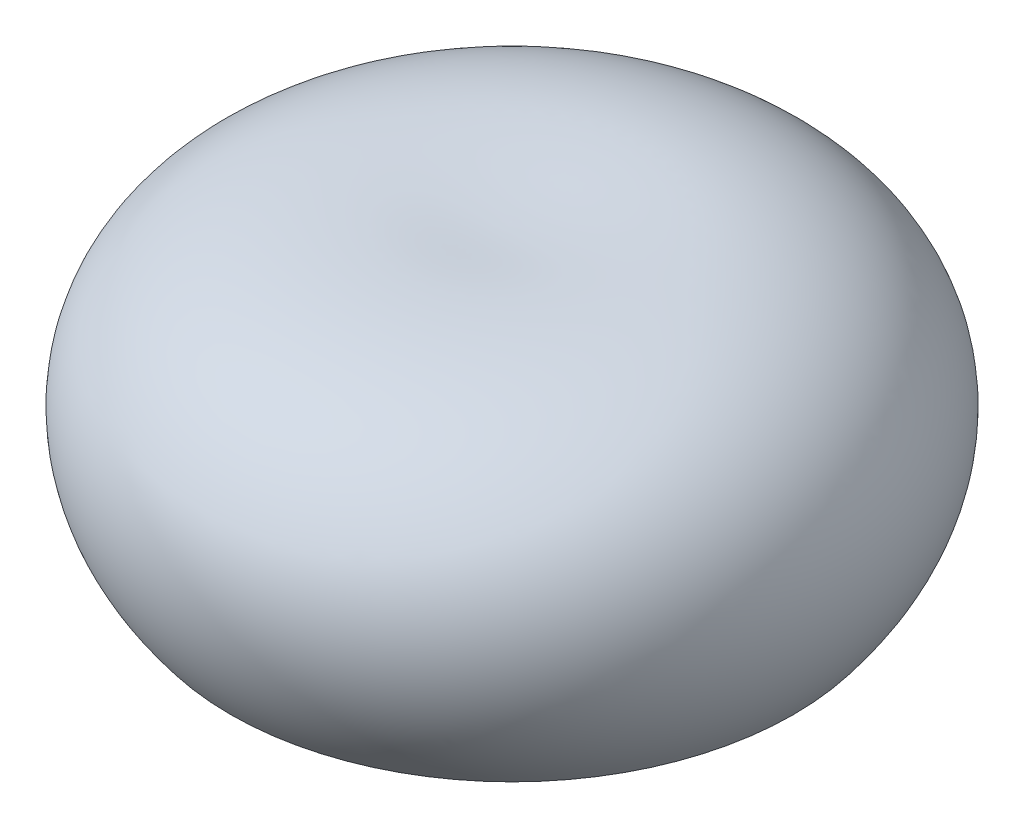
from build123d import *


with BuildPart() as part:
    # 草图3 → 旋转1 (revolve)
    with BuildSketch(Plane.XY):
        with BuildLine():
            Line((0, 7), (0, 0))
            Line((0, 0), (6.871524, 0))
            add(Edge.make_bspline(
                [(0, 7), (0.073827133, 6.999533892), (0.178318357, 6.998874186), (0.306371082, 7.001499066), (0.380532001, 7.003447371), (0.44163275, 7.005414874), (0.495099375, 7.007375358), (0.543337939, 7.009328467), (0.587692174, 7.011274662), (0.62900892, 7.013208302), (0.667864574, 7.01513245), (0.704674056, 7.01704083), (0.739746516, 7.018935719), (0.773321365, 7.020815477), (0.805587195, 7.022680946), (0.836696698, 7.024531001), (0.866775289, 7.026364097), (0.895926819, 7.028182386), (0.92424, 7.029984755), (0.951789678, 7.031768518), (0.978640164, 7.033538818), (1.004847801, 7.035290763), (1.030461401, 7.037026909), (1.055524621, 7.038747334), (1.080075561, 7.040450285), (1.104148873, 7.042135989), (1.127774491, 7.043805743), (1.150980061, 7.045459817), (1.173790345, 7.047096538), (1.196228349, 7.048715852), (1.21831425, 7.050319891), (1.240066936, 7.05190598), (1.261503173, 7.053476977), (1.282639187, 7.055030127), (1.303489485, 7.056567608), (1.324067415, 7.058089226), (1.344385372, 7.05959381), (1.364454785, 7.06108041), (1.38428631, 7.062553647), (1.403890354, 7.064008392), (1.423276267, 7.065448232), (1.442452636, 7.066870081), (1.461427601, 7.068276548), (1.480208588, 7.069666736), (1.498802901, 7.071041002), (1.517217542, 7.072399364), (1.535458874, 7.073741376), (1.553532799, 7.075068082), (1.571445213, 7.076376654), (1.589201149, 7.077671204), (1.606806139, 7.078949351), (1.624264792, 7.080211552), (1.641582107, 7.081457816), (1.65876215, 7.082687569), (1.675808752, 7.08390315), (1.692726084, 7.085102192), (1.709518068, 7.086285448), (1.726188441, 7.087452225), (1.742740379, 7.088604811), (1.759177426, 7.089740488), (1.775502371, 7.090861982), (1.791718366, 7.091967091), (1.807828401, 7.09305595), (1.823835055, 7.094130165), (1.839741065, 7.095189049), (1.85554896, 7.096234019), (1.871261098, 7.097259952), (1.886879701, 7.098273623), (1.902406998, 7.099271914), (1.917845712, 7.100253549), (1.933197649, 7.101221273), (1.948464748, 7.102171391), (1.963648643, 7.103109491), (1.978751408, 7.104029595), (1.993774643, 7.104937619), (2.008720735, 7.105827809), (2.02359065, 7.106705638), (2.038386356, 7.107566375), (2.053109061, 7.108412093), (2.067760644, 7.109244979), (2.082342731, 7.110060174), (2.096856351, 7.110862757), (2.111302695, 7.111649647), (2.125683354, 7.112421865), (2.139999726, 7.113178548), (2.154253027, 7.113921927), (2.16844436, 7.114650026), (2.182574738, 7.115362568), (2.196645325, 7.116062617), (2.210657444, 7.116744277), (2.224611994, 7.11741581), (2.238510113, 7.11806838), (2.252352674, 7.118710787), (2.266140749, 7.119334935), (2.27987541, 7.11994616), (2.293557055, 7.120543437), (2.307187085, 7.121125216), (2.320766088, 7.121693253), (2.334295403, 7.122247514), (2.347775404, 7.122786663), (2.361207128, 7.123309997), (2.374590743, 7.123821817), (2.387927781, 7.124317303), (2.40121842, 7.124799912), (2.414463811, 7.125266091), (2.42766443, 7.125720992), (2.440821131, 7.126159489), (2.453934464, 7.126584694), (2.46700514, 7.126995587), (2.480033455, 7.127393071), (2.493020504, 7.127774283), (2.505966464, 7.128144259), (2.518872515, 7.128497291), (2.53173881, 7.128839321), (2.544566191, 7.12916436), (2.557354824, 7.129478356), (2.570105535, 7.129775418), (2.582818505, 7.130061396), (2.595494544, 7.13033055), (2.608134199, 7.130588093), (2.620737876, 7.130830963), (2.633305882, 7.131060023), (2.645838889, 7.131275039), (2.658337228, 7.131476135), (2.670801578, 7.131662797), (2.683232241, 7.131837195), (2.695629583, 7.131997104), (2.707994257, 7.132143137), (2.720326263, 7.132275252), (2.732626277, 7.132392878), (2.74489461, 7.132498364), (2.757131624, 7.132588915), (2.769337959, 7.132667332), (2.781513968, 7.132731228), (2.793659642, 7.132781331), (2.805775651, 7.132817122), (2.817861991, 7.132839974), (2.829919332, 7.132850856), (2.841948005, 7.132844583), (2.853948349, 7.132828886), (2.865920688, 7.132796049), (2.877865028, 7.132751192), (2.889781706, 7.132693532), (2.901671376, 7.13262113), (2.913534055, 7.132536469), (2.925370399, 7.132437615), (2.937180391, 7.132323773), (2.948964424, 7.132200075), (2.960722739, 7.132058795), (2.972455433, 7.13190768), (2.984163107, 7.131741519), (2.995845773, 7.131561314), (3.007504115, 7.131368402), (3.019137788, 7.131162311), (3.030747477, 7.130943692), (3.042332803, 7.130710275), (3.053894828, 7.130464707), (3.065433155, 7.130204358), (3.076948499, 7.129931482), (3.088440504, 7.129645373), (3.099909865, 7.129346746), (3.111356854, 7.129033383), (3.122781534, 7.128707543), (3.134184204, 7.128368389), (3.145564902, 7.128016801), (3.156923889, 7.127650437), (3.168261235, 7.127271563), (3.179577238, 7.126879419), (3.190872277, 7.126474928), (3.202146231, 7.126055113), (3.213399629, 7.125624928), (3.224632274, 7.125179472), (3.235844622, 7.124721627), (3.247036956, 7.124250438), (3.258209338, 7.123767022), (3.269361943, 7.123268103), (3.280494695, 7.122759108), (3.291607959, 7.122234128), (3.302701711, 7.121699042), (3.313776343, 7.121148487), (3.324832028, 7.12058567), (3.335869035, 7.120009645), (3.346887376, 7.119420627), (3.357887055, 7.11881868), (3.368868395, 7.118203643), (3.379831407, 7.117575692), (3.390776409, 7.116934577), (3.401703467, 7.116281047), (3.412612724, 7.115612321), (3.423504444, 7.11493271), (3.434378498, 7.114240055), (3.44523475, 7.113532344), (3.456074141, 7.112813747), (3.466896485, 7.112081762), (3.477701817, 7.111336625), (3.488489885, 7.110579101), (3.499261125, 7.109806343), (3.510016192, 7.109022811), (3.520754863, 7.108225739), (3.531476876, 7.107415787), (3.542182545, 7.106592699), (3.552872223, 7.105756727), (3.563545915, 7.104907913), (3.574203518, 7.104045357), (3.584845313, 7.103172137), (3.595471594, 7.102283709), (3.606082229, 7.101382573), (3.616677284, 7.100469781), (3.627256687, 7.099544119), (3.637820904, 7.098603366), (3.648370328, 7.097651946), (3.658904656, 7.096686772), (3.669423667, 7.095708786), (3.67992769, 7.094717923), (3.690416948, 7.093713383), (3.700891776, 7.092698276), (3.71135197, 7.091667419), (3.721797724, 7.090625877), (3.732229124, 7.089571093), (3.742645685, 7.088501635), (3.753048344, 7.087420478), (3.763436836, 7.086328227), (3.773811426, 7.085220735), (3.784171725, 7.084100672), (3.794518457, 7.082968843), (3.804851134, 7.081823846), (3.815170148, 7.080665884), (3.825475479, 7.079494772), (3.835767183, 7.078311001), (3.84604542, 7.077113435), (3.856310283, 7.075905342), (3.866561442, 7.074681465), (3.876799547, 7.073446927), (3.887024559, 7.07219893), (3.897236473, 7.070937498), (3.907435665, 7.069665283), (3.917621172, 7.0683776), (3.927794251, 7.067078815), (3.937954277, 7.065766934), (3.948101629, 7.064441996), (3.958235857, 7.063103463), (3.968358062, 7.06175425), (3.978467235, 7.06038965), (3.988564318, 7.059013852), (3.998648667, 7.057624891), (4.008720701, 7.056223059), (4.018780237, 7.054807393), (4.028827819, 7.053381402), (4.038862939, 7.051939503), (4.048886063, 7.050486965), (4.058897075, 7.049020967), (4.068895971, 7.047541534), (4.0788832, 7.04605133), (4.088857991, 7.044545536), (4.098821127, 7.043029031), (4.108772433, 7.041498786), (4.118711818, 7.039956047), (4.128639788, 7.038399785), (4.138555747, 7.036830796), (4.148460496, 7.035249914), (4.158353495, 7.033655841), (4.168235195, 7.032048984), (4.178105515, 7.030428832), (4.18796423, 7.02879606), (4.197811442, 7.027149606), (4.207647567, 7.025491953), (4.217472252, 7.023820992), (4.227285893, 7.022136783), (4.237088274, 7.020439997), (4.246879619, 7.018729994), (4.256659491, 7.017006548), (4.266428764, 7.015272353), (4.276186825, 7.013522435), (4.285934358, 7.011762152), (4.295670652, 7.009987873), (4.305396008, 7.008200935), (4.315110558, 7.006400587), (4.324814837, 7.004589353), (4.334507582, 7.002762599), (4.344190052, 7.000924937), (4.35386173, 6.999073937), (4.36352275, 6.99720998), (4.373173066, 6.995332832), (4.382813104, 6.993442966), (4.392442644, 6.991539612), (4.40206195, 6.989625421), (4.411669961, 6.987695421), (4.421268286, 6.98575531), (4.430855693, 6.983799644), (4.440433174, 6.981832979), (4.450000162, 6.979852863), (4.459556867, 6.977859996), (4.469103214, 6.975854), (4.478639363, 6.973834416), (4.488165747, 6.971804498), (4.49768153, 6.969758755), (4.507187098, 6.967700589), (4.516683109, 6.965631446), (4.526168423, 6.963546451), (4.535644276, 6.961450921), (4.545110133, 6.95934238), (4.554565447, 6.957218423), (4.564011046, 6.955084215), (4.573446596, 6.952935655), (4.582872499, 6.950775294), (4.592288195, 6.948599592), (4.601694389, 6.94641305), (4.61109067, 6.944212776), (4.620477393, 6.941999965), (4.6298544, 6.939773941), (4.63922141, 6.937534937), (4.648578436, 6.935282993), (4.657925713, 6.933017712), (4.667263621, 6.930740315), (4.676591598, 6.928447484), (4.6859105, 6.926144058), (4.695219492, 6.923826975), (4.704518775, 6.921496728), (4.713808688, 6.919154318), (4.723088659, 6.916796511), (4.732359547, 6.914428003), (4.741621012, 6.912046127), (4.750872387, 6.909649623), (4.760115045, 6.907242158), (4.769347568, 6.904819891), (4.778570929, 6.90238495), (4.787784742, 6.899936539), (4.796989787, 6.89747724), (4.806185087, 6.895003064), (4.815370786, 6.892514574), (4.824547673, 6.890015011), (4.833715144, 6.887502128), (4.842872512, 6.88497467), (4.852021466, 6.882435993), (4.861160709, 6.879882955), (4.870291028, 6.87731686), (4.879411734, 6.874737958), (4.888523519, 6.872145992), (4.897625582, 6.869539672), (4.906719263, 6.866922171), (4.915803066, 6.864289775), (4.924877807, 6.861644991), (4.933943581, 6.858986975), (4.94299965, 6.856314704), (4.952047615, 6.853631002), (4.961085825, 6.850932877), (4.970115368, 6.848222194), (4.979134964, 6.845496485), (4.988146403, 6.84276022), (4.997148149, 6.84000868), (5.006141431, 6.83724522), (5.015125011, 6.834466485), (5.02410015, 6.831677299), (5.033065706, 6.828872897), (5.042022067, 6.826054552), (5.050970484, 6.823225166), (5.059908979, 6.820380913), (5.068838767, 6.817523916), (5.077759314, 6.814652837), (5.086671321, 6.811768821), (5.095574521, 6.808872058), (5.104468083, 6.805961029), (5.113352619, 6.803036595), (5.1222286, 6.800100168), (5.131095614, 6.797148503), (5.139954357, 6.794185351), (5.148803358, 6.791206655), (5.157643688, 6.788216255), (5.16647445, 6.785210206), (5.175297627, 6.782194633), (5.18411069, 6.779161498), (5.192915495, 6.776116863), (5.201711701, 6.773059081), (5.210498474, 6.769986725), (5.21927674, 6.766902107), (5.228045508, 6.763802744), (5.236806024, 6.760690887), (5.245557278, 6.757564957), (5.254300049, 6.754425875), (5.26303357, 6.751272767), (5.271758788, 6.748106997), (5.280474823, 6.744927049), (5.289181844, 6.741732494), (5.29788063, 6.73852635), (5.306569858, 6.735304461), (5.315250922, 6.732071155), (5.323922602, 6.728822598), (5.332586169, 6.725562394), (5.341239407, 6.722285342), (5.349885207, 6.718998409), (5.358520913, 6.715694395), (5.367149003, 6.712379128), (5.375767722, 6.709048695), (5.384377988, 6.705706009), (5.392978965, 6.702348911), (5.401571278, 6.698977818), (5.410154755, 6.695592637), (5.418730316, 6.692195344), (5.427295533, 6.688781343), (5.435853353, 6.685357356), (5.444400779, 6.681916555), (5.452940589, 6.67846403), (5.4614706, 6.674995864), (5.469992406, 6.671514836), (5.478504862, 6.668019623), (5.487009418, 6.664512264), (5.495504116, 6.660988362), (5.503990977, 6.657453258), (5.512468388, 6.65390261), (5.520937205, 6.650338931), (5.529397195, 6.64676087), (5.537848221, 6.643168893), (5.546290215, 6.639562842), (5.5547233, 6.635943001), (5.563147213, 6.632308328), (5.571563357, 6.628662494), (5.579969204, 6.624999241), (5.588367621, 6.621325253), (5.596756017, 6.61763451), (5.605136592, 6.61393211), (5.613507338, 6.610213829), (5.621869127, 6.606481658), (5.630222843, 6.60273681), (5.638567155, 6.598977057), (5.646902606, 6.595202545), (5.655229219, 6.591415123), (5.663546642, 6.587612553), (5.671855457, 6.583796843), (5.680155206, 6.579966985), (5.688445961, 6.576122804), (5.696727209, 6.572263539), (5.705000773, 6.568392043), (5.713264489, 6.564504733), (5.721519508, 6.560603741), (5.729765803, 6.55668899), (5.738002068, 6.55275878), (5.746230019, 6.548815672), (5.754448851, 6.544857976), (5.762658307, 6.540884486), (5.770859898, 6.536899), (5.779051608, 6.532897702), (5.787234608, 6.528882671), (5.795408715, 6.524854192), (5.803572831, 6.520809379), (5.811728496, 6.516752012), (5.819875135, 6.512679588), (5.828012468, 6.508592886), (5.836140991, 6.50449189), (5.844259923, 6.500375398), (5.852370543, 6.496245929), (5.860471776, 6.492102014), (5.868563261, 6.487942623), (5.87664547, 6.483768374), (5.884720161, 6.479582312), (5.892783757, 6.475378525), (5.900838844, 6.47116166), (5.908885114, 6.466930805), (5.916921597, 6.462684756), (5.924949633, 6.458424748), (5.932967338, 6.454148537), (5.940977502, 6.449860053), (5.948976347, 6.445554492), (5.956967513, 6.441236998), (5.964947875, 6.436902452), (5.972920211, 6.432554705), (5.980883037, 6.428191956), (5.988835952, 6.423813497), (5.996780244, 6.41942166), (6.004715096, 6.415014956), (6.01263996, 6.410592415), (6.020556163, 6.406157004), (6.028462416, 6.401705237), (6.036359963, 6.397240168), (6.044247324, 6.392758592), (6.052125055, 6.388262424), (6.059994643, 6.38375275), (6.067853728, 6.379226947), (6.075703555, 6.374686283), (6.083544222, 6.370131823), (6.091375221, 6.365561786), (6.099196402, 6.360976492), (6.107008259, 6.356376782), (6.114810255, 6.35176174), (6.122602508, 6.34713157), (6.130385168, 6.342486304), (6.138159628, 6.337827926), (6.145923267, 6.333152623), (6.153677365, 6.32846275), (6.161421526, 6.323757433), (6.169156335, 6.319037634), (6.176881721, 6.314302893), (6.184596204, 6.309551146), (6.192302793, 6.304786938), (6.199998088, 6.300005435), (6.207684915, 6.295210528), (6.215361251, 6.290399829), (6.223027942, 6.285573499), (6.230684163, 6.280731428), (6.238331834, 6.275875785), (6.245968443, 6.271003471), (6.253595824, 6.266116697), (6.261212544, 6.26121356), (6.268819702, 6.256295258), (6.276417463, 6.251362883), (6.284004924, 6.2464142), (6.29158282, 6.241451023), (6.299149384, 6.23646998), (6.306707815, 6.231476944), (6.314254907, 6.226466541), (6.321791744, 6.2214401), (6.329319857, 6.216399897), (6.33683667, 6.211342421), (6.344343619, 6.206270315), (6.351841259, 6.201184045), (6.359326406, 6.196078783), (6.366804294, 6.190962021), (6.374269679, 6.18582627), (6.381725764, 6.180676366), (6.389172353, 6.175511512), (6.396607654, 6.170329618), (6.404032733, 6.165132224), (6.411448329, 6.159920842), (6.41885173, 6.154691153), (6.426246232, 6.149447496), (6.433629763, 6.14418714), (6.441004374, 6.138912758), (6.448366686, 6.133620431), (6.455719187, 6.128313298), (6.463061071, 6.122990563), (6.470392195, 6.11765124), (6.477713217, 6.112296238), (6.485024095, 6.106925493), (6.492324137, 6.101538513), (6.499612814, 6.096135378), (6.506891576, 6.090717254), (6.514159147, 6.085282423), (6.521416328, 6.079831188), (6.528662868, 6.074364322), (6.535899543, 6.068882511), (6.543124112, 6.063383242), (6.550338616, 6.057868532), (6.557540979, 6.052335903), (6.564734231, 6.046789729), (6.571915622, 6.041226003), (6.579086321, 6.035646344), (6.58624622, 6.030050182), (6.593395606, 6.024438728), (6.600532037, 6.018808795), (6.607659703, 6.01316536), (6.614775621, 6.007504219), (6.621880335, 6.00182616), (6.628974316, 5.996132518), (6.636056393, 5.990422166), (6.643127774, 5.984695859), (6.650188613, 5.978953446), (6.657237361, 5.973193433), (6.664274485, 5.967416741), (6.671301723, 5.961625471), (6.678316701, 5.955816005), (6.685320437, 5.949990388), (6.692312838, 5.944147703), (6.699294373, 5.93828964), (6.70626378, 5.932413963), (6.713221842, 5.926522002), (6.720168473, 5.92061326), (6.72710383, 5.914687921), (6.734027814, 5.908746255), (6.74093982, 5.902786841), (6.747840861, 5.896811238), (6.754729475, 5.890818094), (6.761606891, 5.884809202), (6.768471887, 5.878782783), (6.775325873, 5.872740111), (6.7821679, 5.866680106), (6.788997897, 5.860602695), (6.795816904, 5.854509413), (6.802622934, 5.848397668), (6.80941793, 5.842270001), (6.816200905, 5.836125305), (6.822971003, 5.829962645), (6.829729916, 5.823783883), (6.836477332, 5.817588326), (6.843210595, 5.811373438), (6.849934374, 5.805144298), (6.856643941, 5.79889577), (6.863342046, 5.79263085), (6.870028327, 5.78634878), (6.876702009, 5.780049093), (6.883363037, 5.773731737), (6.890012386, 5.767397736), (6.896649052, 5.761046031), (6.903273089, 5.754676689), (6.909885403, 5.748290648), (6.916485362, 5.741886912), (6.923072103, 5.735464943), (6.929646105, 5.729025572), (6.936208465, 5.722569908), (6.942757431, 5.7160955), (6.949294139, 5.70960384), (6.955818424, 5.703094757), (6.962329499, 5.696567794), (6.968827171, 5.690022437), (6.975313488, 5.683460713), (6.981786483, 5.676880997), (6.988245459, 5.670282285), (6.994692608, 5.66366672), (7.001126145, 5.65703257), (7.007547938, 5.650381633), (7.013955148, 5.643711504), (7.020350612, 5.637024899), (7.026731837, 5.630319107), (7.033100301, 5.623595863), (7.039455576, 5.616854439), (7.045797881, 5.610095356), (7.052126638, 5.603317735), (7.058441296, 5.596521406), (7.064743924, 5.589708287), (7.071032997, 5.582876621), (7.077307242, 5.576025256), (7.083570042, 5.569157588), (7.089817601, 5.562270482), (7.09605199, 5.555365163), (7.102272687, 5.548441488), (7.108479705, 5.541499467), (7.114673022, 5.534539083), (7.120852695, 5.527560387), (7.127019059, 5.520563337), (7.133170693, 5.513547313), (7.139309051, 5.506513255), (7.145433062, 5.499460226), (7.151542742, 5.492388248), (7.157639101, 5.485298187), (7.163721055, 5.47818911), (7.169788822, 5.471061491), (7.17584236, 5.463914679), (7.181881859, 5.456749448), (7.187907074, 5.449564979), (7.193918168, 5.442362298), (7.199914135, 5.435139955), (7.205896069, 5.427898866), (7.211864309, 5.420639572), (7.217816016, 5.413359478), (7.223755295, 5.406062212), (7.229679087, 5.398745005), (7.23558862, 5.391409061), (7.24148172, 5.384052704), (7.247362726, 5.376679333), (7.253226039, 5.369284553), (7.259076625, 5.361871909), (7.264911214, 5.354438881), (7.270731246, 5.34698687), (7.276536603, 5.339515775), (7.282326185, 5.332024748), (7.288101644, 5.324514985), (7.293860524, 5.316984598), (7.299604355, 5.309434766), (7.305333219, 5.301865627), (7.311048043, 5.294277792), (7.316745151, 5.286668502), (7.322428806, 5.279040867), (7.328095191, 5.27139246), (7.333748018, 5.26372561), (7.339383602, 5.256037596), (7.345003441, 5.248329774), (7.350607576, 5.24060226), (7.356197062, 5.232855479), (7.361769311, 5.225087567), (7.367327047, 5.217300387), (7.372867655, 5.209492402), (7.378392764, 5.201664441), (7.383901626, 5.193816306), (7.389395182, 5.185948552), (7.394870551, 5.178058945), (7.400331839, 5.170150568), (7.40577609, 5.162221364), (7.411202687, 5.154271155), (7.416614075, 5.146301047), (7.42200876, 5.138310353), (7.427387187, 5.130299265), (7.432747628, 5.122266964), (7.438093498, 5.114215056), (7.44342071, 5.106141162), (7.448732261, 5.098047149), (7.454025617, 5.089931807), (7.459304585, 5.08179716), (7.464564054, 5.073639892), (7.469806842, 5.065462052), (7.475033465, 5.057263742), (7.480242048, 5.04904377), (7.485434295, 5.040803095), (7.490608058, 5.032540697), (7.495765282, 5.024258003), (7.500904358, 5.015953469), (7.506026237, 5.007627892), (7.511130254, 4.99928086), (7.516216356, 4.990912346), (7.521285551, 4.982522624), (7.526336177, 4.974110691), (7.531369553, 4.965677541), (7.5363842, 4.957222623), (7.54138155, 4.948746455), (7.546360421, 4.940248338), (7.55132169, 4.931728645), (7.556263132, 4.923186421), (7.561187918, 4.914623164), (7.566093037, 4.906037288), (7.570982211, 4.897430622), (7.575849112, 4.888799728), (7.580700946, 4.880148715), (7.58553133, 4.871473957), (7.590344925, 4.862778096), (7.595138433, 4.85405963), (7.599912969, 4.845318517), (7.60466865, 4.836555148), (7.609405502, 4.827769028), (7.614124155, 4.818961177), (7.618821179, 4.810129596), (7.623502644, 4.801277186), (7.628160136, 4.792399492), (7.632802297, 4.783501245), (7.63742173, 4.774578558), (7.64202277, 4.765633539), (7.646605203, 4.756666055), (7.651165622, 4.747674378), (7.655708216, 4.738660969), (7.660228902, 4.7296231), (7.664730914, 4.72056306), (7.66921221, 4.711478833), (7.673673795, 4.702371913), (7.678115293, 4.693241442), (7.682535109, 4.684087146), (7.68693506, 4.67490908), (7.691315256, 4.665707777), (7.695673014, 4.656481969), (7.700011109, 4.647233459), (7.704328227, 4.637960648), (7.70862543, 4.628664337), (7.712900165, 4.619343015), (7.717154186, 4.609997981), (7.721387369, 4.600629167), (7.725598402, 4.591235652), (7.729788165, 4.581817835), (7.733957334, 4.572376012), (7.738104511, 4.562909708), (7.742229312, 4.553418907), (7.746332491, 4.543903129), (7.750414558, 4.534363061), (7.754473204, 4.524797248), (7.75851153, 4.515207953), (7.762526542, 4.505593105), (7.766519771, 4.495953621), (7.770489039, 4.486288002), (7.774439203, 4.476598502), (7.778363151, 4.466882091), (7.7822669, 4.457141611), (7.786145474, 4.447374794), (7.79000259, 4.437583259), (7.793836733, 4.427765933), (7.797647649, 4.417922852), (7.80143588, 4.408054019), (7.805199598, 4.398159195), (7.808939908, 4.38823847), (7.812656525, 4.378291614), (7.816351124, 4.368319032), (7.820019587, 4.358319207), (7.823666138, 4.348293933), (7.827286398, 4.338241377), (7.830885147, 4.328163501), (7.834458135, 4.318058442), (7.838005484, 4.307925933), (7.84153145, 4.297767564), (7.845029471, 4.28758128), (7.848505208, 4.27736893), (7.851955197, 4.267129317), (7.855378833, 4.256861589), (7.858779006, 4.246567484), (7.862153266, 4.236245406), (7.865501822, 4.225895879), (7.868826293, 4.215518752), (7.872123952, 4.205113925), (7.875396361, 4.194681334), (7.878642135, 4.184220543), (7.881862079, 4.173731475), (7.88505633, 4.163214599), (7.888223225, 4.152669079), (7.891364118, 4.142094997), (7.894479541, 4.131492595), (7.897566006, 4.120860859), (7.900627452, 4.11020103), (7.903660986, 4.099512179), (7.906668909, 4.088794475), (7.909646911, 4.078047051), (7.912599622, 4.067270617), (7.915523386, 4.056464829), (7.918419176, 4.045629298), (7.921288755, 4.034764571), (7.924128358, 4.023869323), (7.926940354, 4.012944268), (7.929724655, 4.001989373), (7.932479291, 3.991003809), (7.935206875, 3.979988394), (7.937903098, 3.968941985), (7.940572778, 3.957865509), (7.943212509, 3.946758132), (7.945822874, 3.935619492), (7.948402355, 3.924449571), (7.950953662, 3.91324866), (7.953474714, 3.90201628), (7.955965461, 3.8907525), (7.958426906, 3.879457277), (7.96085662, 3.868129751), (7.963256643, 3.856770435), (7.965625852, 3.845378752), (7.967963543, 3.833954963), (7.970271131, 3.822498753), (7.972545235, 3.811009386), (7.974791247, 3.799487718), (7.977002638, 3.787932806), (7.979182691, 3.776344696), (7.981332064, 3.764723493), (7.983447538, 3.753068275), (7.985532121, 3.741379711), (7.987582751, 3.729657249), (7.98960087, 3.717900542), (7.991586162, 3.706109915), (7.993536398, 3.694284285), (7.995456365, 3.682424541), (7.997339946, 3.670529353), (7.999189464, 3.658599168), (8.001007683, 3.646634105), (8.002787223, 3.634633008), (8.004536478, 3.62259694), (8.006247855, 3.610524735), (8.007924962, 3.598416354), (8.009567183, 3.586271694), (8.011172681, 3.574090186), (8.012744497, 3.561872309), (8.014277452, 3.549617029), (8.015777601, 3.537325224), (8.017237739, 3.524995639), (8.018663076, 3.512628652), (8.020051363, 3.500223317), (8.021400739, 3.487779811), (8.02271432, 3.475297839), (8.023988897, 3.462777393), (8.025226396, 3.450217738), (8.02642385, 3.437618917), (8.027584078, 3.4249809), (8.028705416, 3.412303219), (8.029785868, 3.399585406), (8.030828287, 3.386827063), (8.031829946, 3.374028297), (8.032792442, 3.361188618), (8.033712735, 3.348307805), (8.034594626, 3.335385503), (8.035432523, 3.322421316), (8.036232716, 3.309415376), (8.036987673, 3.296366867), (8.037703413, 3.28327587), (8.038375121, 3.270141777), (8.039004165, 3.256964369), (8.039589992, 3.243743285), (8.040133264, 3.230477899), (8.040632009, 3.217168145), (8.041087271, 3.203813753), (8.041497124, 3.190414334), (8.041862089, 3.176969254), (8.042181933, 3.163478505), (8.042457114, 3.149941436), (8.042686211, 3.136358027), (8.042868116, 3.122727276), (8.043002966, 3.109049526), (8.043091166, 3.095323779), (8.043131047, 3.081549694), (8.043122814, 3.067726945), (8.043067362, 3.053855188), (8.04296086, 3.039933773), (8.04280576, 3.025962358), (8.042602169, 3.011940256), (8.042346997, 2.997867502), (8.042040724, 2.983743088), (8.041684381, 2.969566963), (8.041273415, 2.955338587), (8.040812957, 2.941057128), (8.040299088, 2.92672235), (8.039730428, 2.912333299), (8.039110082, 2.897889817), (8.038433611, 2.883391077), (8.037703, 2.868836945), (8.036915195, 2.85422658), (8.036074221, 2.839559034), (8.035173081, 2.82483438), (8.03421799, 2.810051161), (8.033202376, 2.795209791), (8.032129373, 2.780308671), (8.030997805, 2.765347485), (8.029804215, 2.750325455), (8.028551351, 2.735241983), (8.027237389, 2.720096513), (8.025861056, 2.704888441), (8.024423446, 2.689616569), (8.022920881, 2.674280184), (8.021355631, 2.658878263), (8.019722416, 2.643410687), (8.018027201, 2.627876053), (8.016263955, 2.612273595), (8.01443288, 2.596602491), (8.012533406, 2.580862105), (8.010567073, 2.565051115), (8.008528188, 2.549169156), (8.006420905, 2.533214145), (8.004239189, 2.517186166), (8.001986131, 2.501083346), (7.999660351, 2.484905098), (7.997259206, 2.468650612), (7.994781904, 2.452318482), (7.992228021, 2.435907619), (7.98959568, 2.419416493), (7.986884586, 2.402843993), (7.984093493, 2.386188823), (7.981221484, 2.369449912), (7.978266317, 2.352626079), (7.975226642, 2.335715736), (7.972104579, 2.318716846), (7.968892204, 2.301629026), (7.96559505, 2.284449531), (7.962206088, 2.267177909), (7.958728562, 2.249811802), (7.955156789, 2.232350479), (7.951493025, 2.214791073), (7.947732399, 2.197132316), (7.943875738, 2.179371942), (7.939918716, 2.161508607), (7.935863557, 2.14353962), (7.931702023, 2.125463888), (7.927439857, 2.107277885), (7.923068733, 2.088980571), (7.918591011, 2.070568759), (7.914001674, 2.052040833), (7.909298838, 2.033394035), (7.904482121, 2.014625191), (7.899546036, 1.995732206), (7.894492603, 1.976711425), (7.88931318, 1.957561618), (7.884011447, 1.938277563), (7.878579797, 1.91885769), (7.873017173, 1.899297716), (7.867320676, 1.879594367), (7.861487338, 1.85974353), (7.855512469, 1.839741943), (7.849394428, 1.819584894), (7.843126049, 1.799269221), (7.836707928, 1.778789176), (7.830132832, 1.758140863), (7.823398223, 1.737319056), (7.8164993, 1.716318122), (7.80943092, 1.695133099), (7.802186127, 1.673758776), (7.794764789, 1.652187377), (7.787156529, 1.630413955), (7.779357217, 1.608430762), (7.771361341, 1.586230611), (7.763160488, 1.563806258), (7.754750512, 1.541148197), (7.746120689, 1.518248683), (7.737265217, 1.495097435), (7.728174395, 1.471684966), (7.718839043, 1.448000361), (7.709251789, 1.424031225), (7.699397336, 1.399766559), (7.68926991, 1.375190965), (7.678852073, 1.350291485), (7.668136035, 1.325050659), (7.65710216, 1.299452572), (7.645736149, 1.273478008), (7.634023807, 1.247105041), (7.621942698, 1.220313153), (7.609474637, 1.193076087), (7.596596098, 1.165366551), (7.583281972, 1.137153935), (7.569501749, 1.10840511), (7.555228619, 1.079079725), (7.540422008, 1.049136817), (7.525047037, 1.018525177), (7.509052502, 0.987191409), (7.492391376, 0.955068273), (7.474996845, 0.922084111), (7.456803632, 0.888148026), (7.437722696, 0.853158989), (7.417655638, 0.816991916), (7.396480397, 0.779494718), (7.374044852, 0.7404813), (7.350160446, 0.699713086), (7.324577872, 0.6568859), (7.296975167, 0.611586116), (7.266893365, 0.56324639), (7.233672572, 0.511026735), (7.196266962, 0.453598037), (7.152819449, 0.388578708), (7.099204996, 0.310585168), (7.005651607, 0.178987117), (6.926892082, 0.073886157), (6.871524, 0)],
                knots=[0, 0, 0, 0, 0.016297596, 0.023066801, 0.028274264, 0.032675414, 0.036562599, 0.040085723, 0.043333494, 0.046363861, 0.049216979, 0.051921959, 0.054501007, 0.056971032, 0.059345708, 0.061636059, 0.063851048, 0.065998321, 0.068084197, 0.070114253, 0.072093056, 0.074024709, 0.07591289, 0.077760612, 0.079570806, 0.081345897, 0.083088166, 0.084799522, 0.086481869, 0.088136821, 0.089765927, 0.091370501, 0.092951798, 0.094510986, 0.096049171, 0.097567308, 0.099066272, 0.100546943, 0.102010067, 0.10345644, 0.104886727, 0.106301583, 0.107701529, 0.109087223, 0.110459108, 0.111817696, 0.113163574, 0.114497036, 0.115818518, 0.117128543, 0.118427327, 0.11971531, 0.120992859, 0.122260269, 0.123517763, 0.124765706, 0.12600439, 0.127234035, 0.128454941, 0.129667324, 0.130871408, 0.132067409, 0.133255549, 0.134436051, 0.135609064, 0.136774809, 0.137933495, 0.139085138, 0.140230101, 0.141368453, 0.142500346, 0.143625996, 0.144745412, 0.145858807, 0.146966337, 0.148068067, 0.149164226, 0.150254806, 0.15133996, 0.152419839, 0.153494582, 0.154564199, 0.155628831, 0.156688555, 0.157743516, 0.158793794, 0.159839459, 0.160880584, 0.161917248, 0.162949591, 0.163977625, 0.165001487, 0.166021187, 0.167036864, 0.168048525, 0.169056318, 0.170060167, 0.171060296, 0.172056706, 0.173049469, 0.174038585, 0.175024208, 0.17600626, 0.176984965, 0.177960247, 0.178932187, 0.179900927, 0.180866396, 0.181828671, 0.182787897, 0.183743928, 0.184696989, 0.185647076, 0.186594196, 0.187538417, 0.18847982, 0.189418327, 0.190354089, 0.191287106, 0.192217381, 0.19314506, 0.194070071, 0.194992415, 0.195912313, 0.196829621, 0.197744413, 0.198656836, 0.199566745, 0.200474288, 0.201379466, 0.20228228, 0.203182804, 0.204081041, 0.204977064, 0.205870875, 0.206762401, 0.207651864, 0.208539119, 0.209424238, 0.210307372, 0.211188374, 0.212067319, 0.212944281, 0.213819188, 0.214692188, 0.21556321, 0.216432327, 0.21729954, 0.218164852, 0.219028336, 0.219889921, 0.220749755, 0.221607764, 0.222464025, 0.223318463, 0.224171229, 0.225022176, 0.225871526, 0.226719134, 0.227565072, 0.228409343, 0.229252023, 0.230093111, 0.230932535, 0.231770444, 0.232606767, 0.233441503, 0.234274728, 0.235106442, 0.235936649, 0.236765345, 0.23759261, 0.23841837, 0.239242699, 0.240065672, 0.240887146, 0.241707264, 0.242525959, 0.2433433, 0.244159221, 0.244973867, 0.245787166, 0.24659912, 0.247409802, 0.248219141, 0.249027212, 0.249834016, 0.250639554, 0.251443832, 0.252246916, 0.253048739, 0.253849305, 0.254648682, 0.255446947, 0.256243956, 0.257039784, 0.257834436, 0.258627978, 0.259420416, 0.260211678, 0.261001765, 0.261790826, 0.262578788, 0.263365579, 0.264151343, 0.264936017, 0.265719672, 0.26650223, 0.267283697, 0.268064155, 0.268843666, 0.26962209, 0.270399504, 0.271175908, 0.271951303, 0.272725758, 0.273499214, 0.274271732, 0.275043248, 0.275813843, 0.27658343, 0.277352158, 0.278119897, 0.278886787, 0.279652675, 0.280417717, 0.281181841, 0.281945048, 0.282707414, 0.283468866, 0.284229471, 0.284989175, 0.285748033, 0.286506057, 0.287263248, 0.288019599, 0.288775128, 0.289529747, 0.290283685, 0.291036725, 0.29178894, 0.292540397, 0.293291115, 0.29404093, 0.294790074, 0.295538401, 0.296285914, 0.297032748, 0.297778781, 0.298524067, 0.299268616, 0.300012431, 0.300755502, 0.301497853, 0.302239463, 0.302980345, 0.303720573, 0.304460004, 0.305198856, 0.305936902, 0.3066743, 0.307411052, 0.308147087, 0.308882478, 0.309617156, 0.310351182, 0.311084569, 0.311817246, 0.312549361, 0.31328077, 0.314011547, 0.314741681, 0.315471199, 0.316200149, 0.3169284, 0.317656028, 0.318383106, 0.319109549, 0.319835387, 0.320560593, 0.321285255, 0.322009304, 0.322732739, 0.323455636, 0.324177995, 0.324899732, 0.325620877, 0.326341475, 0.327061558, 0.327781024, 0.328499962, 0.329218375, 0.329936192, 0.330653485, 0.331370315, 0.332086497, 0.332802232, 0.333517437, 0.334232071, 0.334946248, 0.335659914, 0.336373015, 0.337085664, 0.337797735, 0.338509374, 0.339220526, 0.339931161, 0.340641297, 0.341351007, 0.342060221, 0.34276894, 0.343477168, 0.344184904, 0.344892223, 0.345599072, 0.34630549, 0.347011424, 0.347716875, 0.348421917, 0.349126499, 0.349830657, 0.35053434, 0.351237639, 0.351940447, 0.352642876, 0.353344836, 0.354046401, 0.354747553, 0.355448262, 0.356148599, 0.356848529, 0.357548001, 0.358247108, 0.358945741, 0.359644084, 0.360341976, 0.36103949, 0.361736557, 0.36243334, 0.36312966, 0.36382563, 0.36452123, 0.365216393, 0.365911282, 0.366605715, 0.367299878, 0.367993611, 0.368687006, 0.369380024, 0.370072708, 0.370765039, 0.371457041, 0.372148672, 0.372839907, 0.373530889, 0.374221505, 0.374911801, 0.375601686, 0.376291326, 0.37698063, 0.377669598, 0.378358257, 0.379046515, 0.379734514, 0.380422208, 0.381109647, 0.381796716, 0.382483464, 0.383169915, 0.383856094, 0.384541935, 0.385227532, 0.385912816, 0.386597814, 0.387282503, 0.387966911, 0.388651013, 0.389334907, 0.39001843, 0.390701749, 0.39138477, 0.392067521, 0.392750004, 0.393432265, 0.394114193, 0.394795902, 0.395477351, 0.396158517, 0.396839452, 0.397520082, 0.398200487, 0.398880684, 0.399560633, 0.400240311, 0.400919745, 0.401598938, 0.40227796, 0.402956717, 0.403635267, 0.40431353, 0.404991588, 0.405669391, 0.406347063, 0.407024414, 0.407701611, 0.408378559, 0.409055318, 0.4097319, 0.4104082, 0.411084356, 0.411760302, 0.412436041, 0.413111574, 0.413786904, 0.414462032, 0.415137, 0.415811734, 0.41648631, 0.417160723, 0.417834916, 0.418508951, 0.4191828, 0.419856435, 0.420529985, 0.421203289, 0.421876482, 0.422549434, 0.423222279, 0.423894954, 0.424567393, 0.425239764, 0.425911939, 0.426583983, 0.427255868, 0.427927596, 0.428599199, 0.429270552, 0.429941852, 0.430613035, 0.43128404, 0.431954933, 0.432625684, 0.433296295, 0.433966736, 0.434637108, 0.43530728, 0.435977421, 0.436647368, 0.437317222, 0.437987018, 0.438656626, 0.439326084, 0.439995523, 0.440664814, 0.441333996, 0.442003067, 0.442672031, 0.443340923, 0.444009647, 0.444678404, 0.445346963, 0.446015496, 0.446683835, 0.447352152, 0.44802038, 0.448688557, 0.44935662, 0.4500246, 0.450692537, 0.451360367, 0.452028122, 0.452695776, 0.453363459, 0.454030983, 0.454698477, 0.455365908, 0.456033351, 0.456700608, 0.45736791, 0.45803513, 0.458702273, 0.459369404, 0.460036463, 0.460703451, 0.461370435, 0.462037379, 0.462704299, 0.463371159, 0.464037962, 0.464704774, 0.465371533, 0.466038282, 0.466705008, 0.467371729, 0.46803837, 0.468705074, 0.469371679, 0.470038352, 0.470704956, 0.47137157, 0.472038159, 0.472704766, 0.473371352, 0.474037982, 0.474704537, 0.47537118, 0.476037794, 0.476704422, 0.477371025, 0.478037667, 0.478704373, 0.479371062, 0.480037758, 0.480704464, 0.481371204, 0.482037978, 0.482704792, 0.483371627, 0.484038486, 0.484705454, 0.48537239, 0.486039358, 0.486706385, 0.487373449, 0.488040595, 0.488707783, 0.489375043, 0.490042291, 0.490709632, 0.491377012, 0.49204449, 0.492712072, 0.4933797, 0.494047377, 0.494715062, 0.495382906, 0.496050808, 0.49671883, 0.497386872, 0.498055027, 0.498723251, 0.499391594, 0.500060027, 0.500728482, 0.501397122, 0.502065848, 0.502734663, 0.503403557, 0.504072559, 0.504741704, 0.505410996, 0.506080393, 0.506749839, 0.507419396, 0.508089169, 0.508759049, 0.509428992, 0.510099114, 0.510769352, 0.511439766, 0.512110256, 0.512780985, 0.51345174, 0.514122683, 0.514793819, 0.515465047, 0.516136474, 0.516808047, 0.517479825, 0.518151756, 0.518823796, 0.519495995, 0.520168413, 0.520840998, 0.521513753, 0.522186736, 0.522859841, 0.523533182, 0.524206706, 0.524880363, 0.525554265, 0.526228361, 0.52690265, 0.527577145, 0.52825184, 0.528926743, 0.529601857, 0.530277236, 0.530952781, 0.531628547, 0.532304589, 0.532980807, 0.533657258, 0.534333995, 0.535010969, 0.535688134, 0.536365545, 0.537043206, 0.537721171, 0.53839934, 0.53907777, 0.539756464, 0.540435425, 0.541114658, 0.541794115, 0.542473902, 0.543153972, 0.543834275, 0.544514923, 0.545195811, 0.545876947, 0.546558489, 0.547240232, 0.547922285, 0.548604704, 0.549287391, 0.549970345, 0.550653678, 0.551337344, 0.552021287, 0.552705572, 0.553390148, 0.554075123, 0.554760396, 0.555445972, 0.556131959, 0.556818256, 0.557504923, 0.558191909, 0.558879273, 0.55956702, 0.560255097, 0.560943565, 0.561632427, 0.562321585, 0.56301125, 0.563701218, 0.564391597, 0.565082345, 0.565773513, 0.566465104, 0.56715703, 0.567849435, 0.56854223, 0.569235419, 0.569929064, 0.5706231, 0.571317556, 0.572012469, 0.572707855, 0.573403662, 0.574099894, 0.574796613, 0.575493765, 0.576191369, 0.576889473, 0.577588024, 0.578287026, 0.578986556, 0.579686546, 0.580387015, 0.581087953, 0.581789438, 0.582491417, 0.583193833, 0.583896796, 0.584600325, 0.585304306, 0.586008863, 0.586713942, 0.587419547, 0.588125682, 0.58883237, 0.58953964, 0.590247413, 0.590955755, 0.59166465, 0.592374166, 0.593084203, 0.593794828, 0.594506027, 0.595217885, 0.595930285, 0.596643293, 0.597356892, 0.598071132, 0.598785995, 0.599501424, 0.600217548, 0.60093431, 0.601651677, 0.602369692, 0.603088321, 0.603807671, 0.604527646, 0.605248251, 0.605969592, 0.606691636, 0.607414326, 0.60813773, 0.60886179, 0.609586575, 0.610312089, 0.611038302, 0.611765192, 0.612492891, 0.613221277, 0.613950412, 0.614680344, 0.615410972, 0.616142372, 0.616874578, 0.617607433, 0.618341205, 0.619075736, 0.619811032, 0.620547127, 0.621284032, 0.622021779, 0.622760347, 0.623499704, 0.624239924, 0.624981013, 0.625722908, 0.626465683, 0.627209277, 0.627953828, 0.628699144, 0.629445495, 0.630192622, 0.630940664, 0.63168966, 0.632439616, 0.633190406, 0.633942168, 0.63469481, 0.6354485, 0.636203118, 0.6369587, 0.637715252, 0.63847275, 0.639231298, 0.639990834, 0.640751336, 0.641512876, 0.642275393, 0.643039059, 0.643803685, 0.644569405, 0.645336099, 0.646103938, 0.646872832, 0.647642844, 0.648413964, 0.649186187, 0.649959464, 0.650733925, 0.651509481, 0.652286207, 0.653064108, 0.653843167, 0.654623321, 0.65540474, 0.656187362, 0.656971143, 0.65775621, 0.65854245, 0.659329919, 0.660118644, 0.660908633, 0.661699941, 0.662492503, 0.663286304, 0.664081467, 0.664877905, 0.665675742, 0.6664748, 0.667275319, 0.668077165, 0.668880393, 0.669684941, 0.670490956, 0.671298376, 0.672107207, 0.672917437, 0.673729164, 0.674542396, 0.675357027, 0.676173178, 0.676990836, 0.677809937, 0.678630682, 0.679452886, 0.680276679, 0.681101997, 0.681928938, 0.682757474, 0.68358763, 0.684419414, 0.685252816, 0.686087934, 0.686924668, 0.687763063, 0.68860325, 0.689445079, 0.690288702, 0.691134071, 0.691981178, 0.692830103, 0.693680784, 0.694533284, 0.695387699, 0.696243879, 0.697101977, 0.697961928, 0.698823799, 0.699687628, 0.700553381, 0.701421008, 0.702290749, 0.703162441, 0.704036106, 0.704911885, 0.705789642, 0.706669531, 0.707551477, 0.708435585, 0.709321829, 0.71021023, 0.711100808, 0.711993613, 0.712888613, 0.71378586, 0.714685372, 0.715587233, 0.716491369, 0.717397873, 0.718306735, 0.719217983, 0.720131601, 0.721047689, 0.721966248, 0.722887354, 0.723810877, 0.724737041, 0.725665708, 0.726597029, 0.727530947, 0.728467466, 0.729406736, 0.730348702, 0.73129344, 0.732240888, 0.733191199, 0.734144314, 0.735100308, 0.736059202, 0.737020992, 0.737985772, 0.738953545, 0.739924322, 0.740898187, 0.741875153, 0.742855302, 0.74383857, 0.744825041, 0.745814799, 0.746807858, 0.747804155, 0.74880392, 0.749807018, 0.750813607, 0.751823627, 0.752837236, 0.753854447, 0.754875199, 0.755899651, 0.756927889, 0.75795978, 0.758995558, 0.760035163, 0.761078681, 0.762126129, 0.763177591, 0.764233157, 0.76529277, 0.766356661, 0.767424703, 0.768497057, 0.76957374, 0.770654837, 0.771740446, 0.772830501, 0.773925249, 0.775024554, 0.776128655, 0.777237579, 0.778351334, 0.779470015, 0.780593717, 0.781722455, 0.782856405, 0.783995655, 0.785140163, 0.786290077, 0.787445508, 0.788606554, 0.789773233, 0.790945634, 0.792123946, 0.793308178, 0.79449852, 0.795694981, 0.796897734, 0.798106818, 0.799322333, 0.800544527, 0.801773358, 0.803009073, 0.804251776, 0.805501497, 0.806758425, 0.808022739, 0.809294529, 0.810573941, 0.8118612, 0.813156366, 0.814459605, 0.815771126, 0.817091022, 0.818419576, 0.819756969, 0.821103255, 0.822458758, 0.82382364, 0.825198121, 0.826582364, 0.827976697, 0.829381267, 0.830796278, 0.832222147, 0.833659026, 0.835107174, 0.836566925, 0.838038519, 0.839522365, 0.841018672, 0.842527884, 0.844050302, 0.845586322, 0.847136319, 0.848700712, 0.85027993, 0.851874394, 0.853484648, 0.855111096, 0.856754401, 0.858414992, 0.860093466, 0.861790539, 0.863506786, 0.86524295, 0.86699973, 0.868777942, 0.870578479, 0.872402187, 0.874250036, 0.876123067, 0.878022393, 0.879949144, 0.881904738, 0.883890413, 0.885907785, 0.887958389, 0.890044173, 0.892166989, 0.894328913, 0.896532365, 0.898779994, 0.901074588, 0.9034194, 0.905818126, 0.90827466, 0.910793736, 0.913380558, 0.916041105, 0.918782464, 0.921612758, 0.924541633, 0.927580675, 0.930743761, 0.934048358, 0.937515971, 0.941174663, 0.945061347, 0.949226715, 0.95374381, 0.958724496, 0.964356825, 0.971007119, 0.979617955, 1, 1, 1, 1], degree=3))
        make_face()
    revolve(axis=Axis((0, 7, 0), (0, -1, 0)))

    # 草图4 → 切除-旋转1 (revolve, cut)
    with BuildSketch(Plane(origin=(0, 0, 0), x_dir=(-1, 0, 0), z_dir=(0, -1, 0))):
        with BuildLine():
            Line((0, -5), (0, 5))
            ThreePointArc((0, 5), (-5, 0), (0, -5))
        make_face()
    revolve(axis=Axis((0, 0, 5), (0, 0, -1)), mode=Mode.SUBTRACT)


solid = part.part
